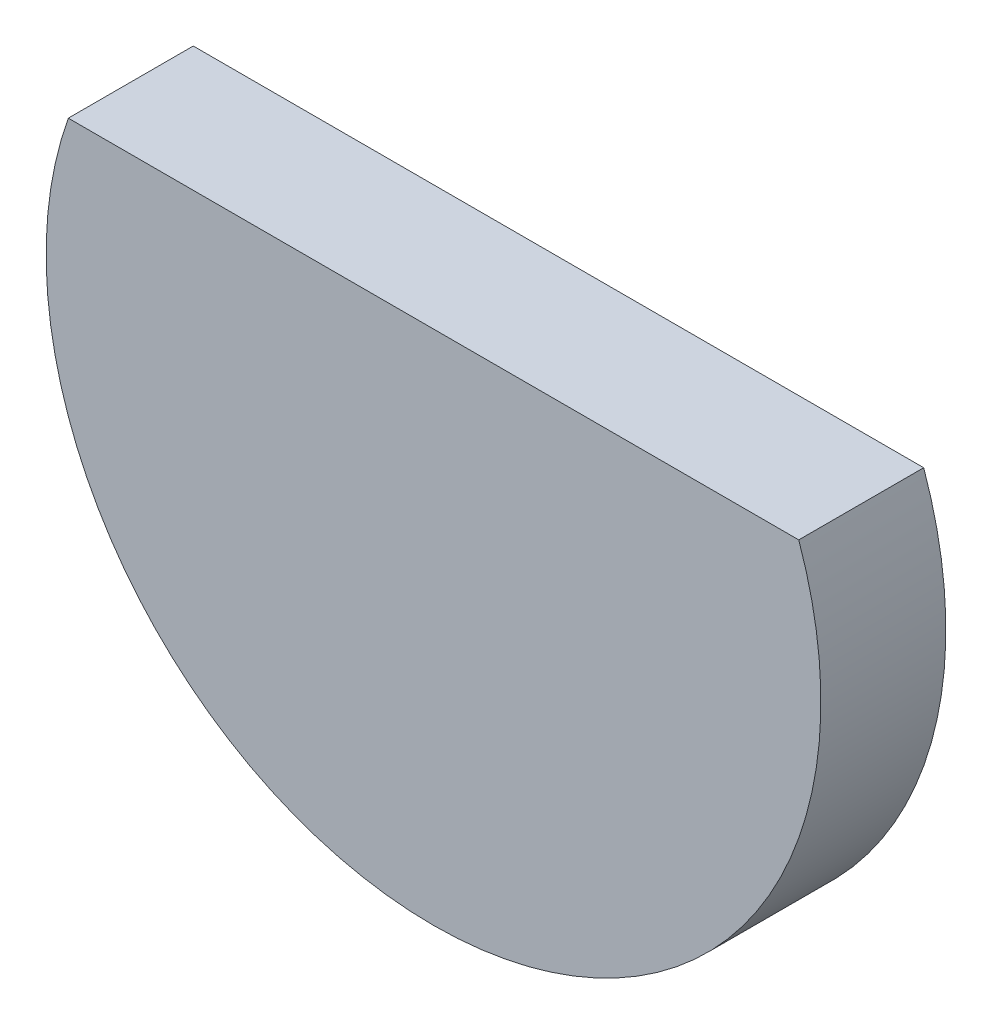
from build123d import *

# Parameters (mm, degrees)
SKETCH1_R           = 12.4
BOSS_EXTRUDE1_DEPTH = 4
CUT_EXTRUDE1_START  = -4
CUT_EXTRUDE1_DEPTH  = 4


with BuildPart() as part:
    # Sketch1 → Boss-Extrude1 (new body)
    with BuildSketch(Plane.XY):
        Circle(SKETCH1_R)
    extrude(amount=BOSS_EXTRUDE1_DEPTH)

    # Sketch2 → Cut-Extrude1 (cut)
    with BuildSketch(Plane.XY.offset(4).offset(CUT_EXTRUDE1_START)):
        with BuildLine():
            Line((-11.690832116, 4.133333333), (11.690832116, 4.133333333))
            ThreePointArc((11.690832116, 4.133333333), (0, 12.4), (-11.690832116, 4.133333333))
        make_face()
    extrude(amount=CUT_EXTRUDE1_DEPTH, mode=Mode.SUBTRACT)


solid = part.part
